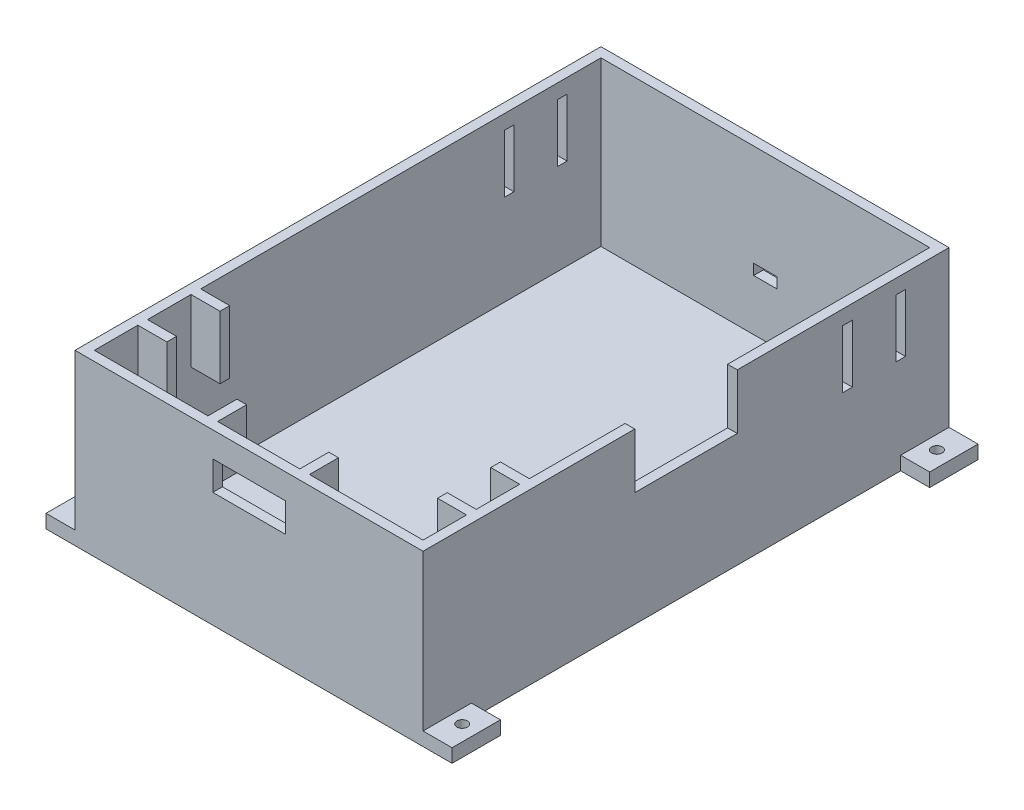
from build123d import *
from build123d.topology import SkipClean

# Parameters (mm, degrees)
ESBO_O1_W                = 36
ESBO_O1_H                = 54.4
ESBO_O1_W_2              = 34
ESBO_O1_H_2              = 52.4
RESSALTO_EXTRUS_O1_DEPTH = 17
ESBO_O2_W                = 34
ESBO_O2_H                = 52.4
RESSALTO_EXTRUS_O2_DEPTH = 0.1
ESBO_O3_W                = 7.5
ESBO_O3_H                = 3
CORTE_EXTRUS_O1_DEPTH    = 5.5
ESBO_O4_W                = 2.4
ESBO_O4_H                = 1.1
CORTE_EXTRUS_O2_DEPTH    = 5.5
ESBO_O5_W                = 3
ESBO_O5_H                = 5
ESBO_O5_R                = 0.55
RESSALTO_EXTRUS_O3_DEPTH = 0.9
ESBO_O7_W                = 10.6
ESBO_O7_H                = 5.7
CORTE_EXTRUS_O3_DEPTH    = 3
ESBO_O8_W                = 1
ESBO_O8_H                = 6.5
RESSALTO_EXTRUS_O4_DEPTH = 3
ESBO_O9_W                = 1
ESBO_O9_H                = 6.5
RESSALTO_EXTRUS_O5_DEPTH = 3
ESBO_O10_W               = 1
ESBO_O10_H               = 5.6
RESSALTO_EXTRUS_O6_DEPTH = 3
RESSALTO_EXTRUS_O7_START = 0.5
ESBO_O11_R               = 0.55
RESSALTO_EXTRUS_O7_DEPTH = 0.5
ESBO_O12_W               = 1
ESBO_O12_H               = 6
CORTE_EXTRUS_O4_DEPTH    = 40


with BuildPart() as part:
    # Esboço1 → Ressalto-extrusão1 (new body)
    with BuildSketch(Plane(origin=(0, 0, 0), x_dir=(1, 0, 0), z_dir=(0, 1, 0))):
        Rectangle(ESBO_O1_W, ESBO_O1_H)
        Rectangle(ESBO_O1_W_2, ESBO_O1_H_2, mode=Mode.SUBTRACT)
    extrude(amount=RESSALTO_EXTRUS_O1_DEPTH)

    # Esboço2 → Ressalto-extrusão2 (add)
    with BuildSketch(Plane(origin=(0, 0, 0), x_dir=(1, 0, 0), z_dir=(0, 1, 0))):
        Rectangle(ESBO_O2_W, ESBO_O2_H)
    extrude(amount=RESSALTO_EXTRUS_O2_DEPTH)

    # Esboço3 → Corte-extrusão1 (cut, symmetric)
    with BuildSketch(Plane.XY.offset(27.2)):
        with Locations((0, 12.9)):
            Rectangle(ESBO_O3_W, ESBO_O3_H)
    extrude(amount=CORTE_EXTRUS_O1_DEPTH, both=True, mode=Mode.SUBTRACT)

    # Esboço4 → Corte-extrusão2 (cut, symmetric)
    with BuildSketch(Plane.XY.offset(-26.2)):
        with Locations((0, 5.95)):
            Rectangle(ESBO_O4_W, ESBO_O4_H)
    extrude(amount=CORTE_EXTRUS_O2_DEPTH, both=True, mode=Mode.SUBTRACT)

    # Esboço5 → Ressalto-extrusão3 (add)
    # profile 1 of 4: a face of its own
    with BuildSketch(Plane(origin=(0, 0, 0), x_dir=(1, 0, 0), z_dir=(0, 1, 0))):
        with Locations((19.5, -24.7)):
            Rectangle(ESBO_O5_W, ESBO_O5_H)
        with Locations(Location((19.4, -24.55, 0), (0, 0, 270))):
            Circle(ESBO_O5_R, mode=Mode.SUBTRACT)
    # profile 2 of 4: a face of its own
    with BuildSketch(Plane(origin=(0, 0, 0), x_dir=(1, 0, 0), z_dir=(0, 1, 0))):
        with Locations((-19.5, -24.7)):
            Rectangle(ESBO_O5_W, ESBO_O5_H)
        with Locations(Location((-19.4, -24.55, 0), (0, 0, 270))):
            Circle(ESBO_O5_R, mode=Mode.SUBTRACT)
    # profile 3 of 4: a face of its own
    with BuildSketch(Plane(origin=(0, 0, 0), x_dir=(1, 0, 0), z_dir=(0, 1, 0))):
        with Locations((-19.5, 24.7)):
            Rectangle(ESBO_O5_W, ESBO_O5_H)
        with Locations(Location((-19.4, 24.55, 0), (0, 0, 270))):
            Circle(ESBO_O5_R, mode=Mode.SUBTRACT)
    # profile 4 of 4: a face of its own
    with BuildSketch(Plane(origin=(0, 0, 0), x_dir=(1, 0, 0), z_dir=(0, 1, 0))):
        with Locations((19.5, 24.7)):
            Rectangle(ESBO_O5_W, ESBO_O5_H)
        with Locations(Location((19.4, 24.55, 0), (0, 0, 270))):
            Circle(ESBO_O5_R, mode=Mode.SUBTRACT)
    extrude(amount=RESSALTO_EXTRUS_O3_DEPTH)

    # Esboço7 → Corte-extrusão3 (cut)
    with BuildSketch(Plane(origin=(18, 0, 0), x_dir=(0, 0, -1), z_dir=(1, 0, 0))):
        with Locations((0, 14.15)):
            Rectangle(ESBO_O7_W, ESBO_O7_H)
    extrude(amount=-CORTE_EXTRUS_O3_DEPTH, mode=Mode.SUBTRACT)

    # Esboço8 → Ressalto-extrusão4 (add)
    with BuildSketch(Plane.ZY.offset(-17)):
        with Locations((15.7, 13.75)):
            Rectangle(ESBO_O8_W, ESBO_O8_H)
        with Locations((21.2, 13.75)):
            Rectangle(ESBO_O8_W, ESBO_O8_H)
    extrude(amount=RESSALTO_EXTRUS_O4_DEPTH)

    # Esboço9 → Ressalto-extrusão5 (add)
    with BuildSketch(Plane(origin=(-17, 0, 0), x_dir=(0, 0, -1), z_dir=(1, 0, 0))):
        with Locations((-21.2, 13.75)):
            Rectangle(ESBO_O9_W, ESBO_O9_H)
        with Locations((-15.7, 13.75)):
            Rectangle(ESBO_O9_W, ESBO_O9_H)
    extrude(amount=RESSALTO_EXTRUS_O5_DEPTH)

    # Esboço10 → Ressalto-extrusão6 (add)
    with BuildSketch(Plane(origin=(0, 0, 26.2), x_dir=(-1, 0, 0), z_dir=(0, 0, -1))):
        with Locations((4.75, 14.2)):
            Rectangle(ESBO_O10_W, ESBO_O10_H)
        with Locations((-4.75, 14.2)):
            Rectangle(ESBO_O10_W, ESBO_O10_H)
    extrude(amount=RESSALTO_EXTRUS_O6_DEPTH)

    # Esboço11 → Ressalto-extrusão7 (add)
    with SkipClean():  # the faces are left unmerged after this step: merging them gives an invalid solid
        with BuildSketch(Plane.XZ.offset(RESSALTO_EXTRUS_O7_START)):
            Polygon((-18, 22.2), (-18, -22.2), (-21, -22.2), (-21, -27.2), (21, -27.2), (21, -22.2), (18, -22.2), (18, 22.2), (21, 22.2), (21, 27.2), (-21, 27.2), (-21, 22.2), align=None)
            with Locations(Location((19.4, -24.55, 0), (0, 0, 270))):
                Circle(ESBO_O11_R, mode=Mode.SUBTRACT)
            with Locations(Location((19.4, 24.55, 0), (0, 0, 270))):
                Circle(ESBO_O11_R, mode=Mode.SUBTRACT)
            with Locations(Location((-19.4, 24.55, 0), (0, 0, 270))):
                Circle(ESBO_O11_R, mode=Mode.SUBTRACT)
            with Locations(Location((-19.4, -24.55, 0), (0, 0, 270))):
                Circle(ESBO_O11_R, mode=Mode.SUBTRACT)
        extrude(amount=-RESSALTO_EXTRUS_O7_DEPTH)

    # Esboço12 → Corte-extrusão4 (cut)
    with SkipClean():  # the faces are left unmerged after this step: merging them gives an invalid solid
        with BuildSketch(Plane(origin=(18, 0, 0), x_dir=(0, 0, -1), z_dir=(1, 0, 0))):
            with Locations((22.2, 12.5)):
                Rectangle(ESBO_O12_W, ESBO_O12_H)
            with Locations((16.7, 12.5)):
                Rectangle(ESBO_O12_W, ESBO_O12_H)
        extrude(amount=-CORTE_EXTRUS_O4_DEPTH, mode=Mode.SUBTRACT)


solid = part.part
